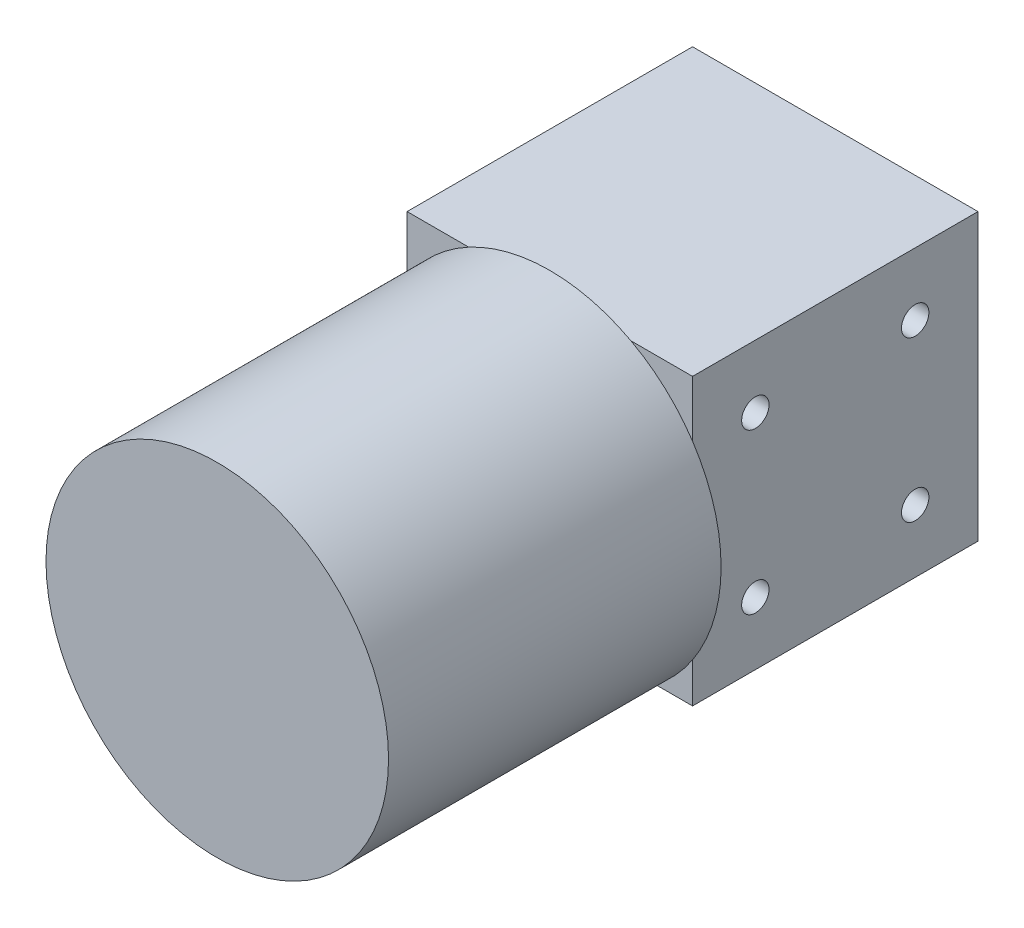
from build123d import *

# Parameters (mm, degrees)
SKETCH1_W           = 50
SKETCH1_H           = 50
BOSS_EXTRUDE1_DEPTH = 50
SKETCH2_R           = 30
BOSS_EXTRUDE2_DEPTH = 58.25
SKETCH3_R           = 7.5
CUT_EXTRUDE1_DEPTH  = 1
SKETCH4_R           = 2.4
CUT_EXTRUDE2_DEPTH  = 15
CUT_EXTRUDE3_START  = -15
SKETCH5_R           = 2.4
CUT_EXTRUDE3_DEPTH  = 15


with BuildPart() as part:
    # Sketch1 → Boss-Extrude1 (new body)
    with BuildSketch(Plane.XY):
        with Locations((25, 1.421800948)):
            Rectangle(SKETCH1_W, SKETCH1_H)
    extrude(amount=BOSS_EXTRUDE1_DEPTH)

    # Sketch2 → Boss-Extrude2 (add)
    with BuildSketch(Plane.XY.offset(50)):
        with Locations(Location((25, 0, 0), (0, 0, 146.442690238))):
            Circle(SKETCH2_R)
    extrude(amount=BOSS_EXTRUDE2_DEPTH)

    # Sketch3 → Cut-Extrude1 (cut)
    with BuildSketch(Plane(origin=(0, 0, 0), x_dir=(-1, 0, 0), z_dir=(0, 0, -1))):
        with Locations((-25, 0)):
            Circle(SKETCH3_R)
    extrude(amount=-CUT_EXTRUDE1_DEPTH, mode=Mode.SUBTRACT)

    # Sketch4 → Cut-Extrude2 (cut)
    with BuildSketch(Plane(origin=(50, 0, 0), x_dir=(0, 0, -1), z_dir=(1, 0, 0))):
        with Locations((-39, 15.421800948)):
            Circle(SKETCH4_R)
        with Locations((-11, 15.421800948)):
            Circle(SKETCH4_R)
        with Locations((-11, -12.578199052)):
            Circle(SKETCH4_R)
        with Locations((-39, -12.578199052)):
            Circle(SKETCH4_R)
    extrude(amount=-CUT_EXTRUDE2_DEPTH, mode=Mode.SUBTRACT)

    # Sketch5 → Cut-Extrude3 (cut)
    with BuildSketch(Plane.ZY.offset(CUT_EXTRUDE3_START)):
        with Locations(Location((11, 15.421800948, 0), (0, 0, 180))):
            Circle(SKETCH5_R)
        with Locations(Location((39, 15.421800948, 0), (0, 0, 180))):
            Circle(SKETCH5_R)
        with Locations(Location((39, -12.578199052, 0), (0, 0, 180))):
            Circle(SKETCH5_R)
        with Locations(Location((11, -12.578199052, 0), (0, 0, 180))):
            Circle(SKETCH5_R)
    extrude(amount=CUT_EXTRUDE3_DEPTH, mode=Mode.SUBTRACT)


solid = part.part
